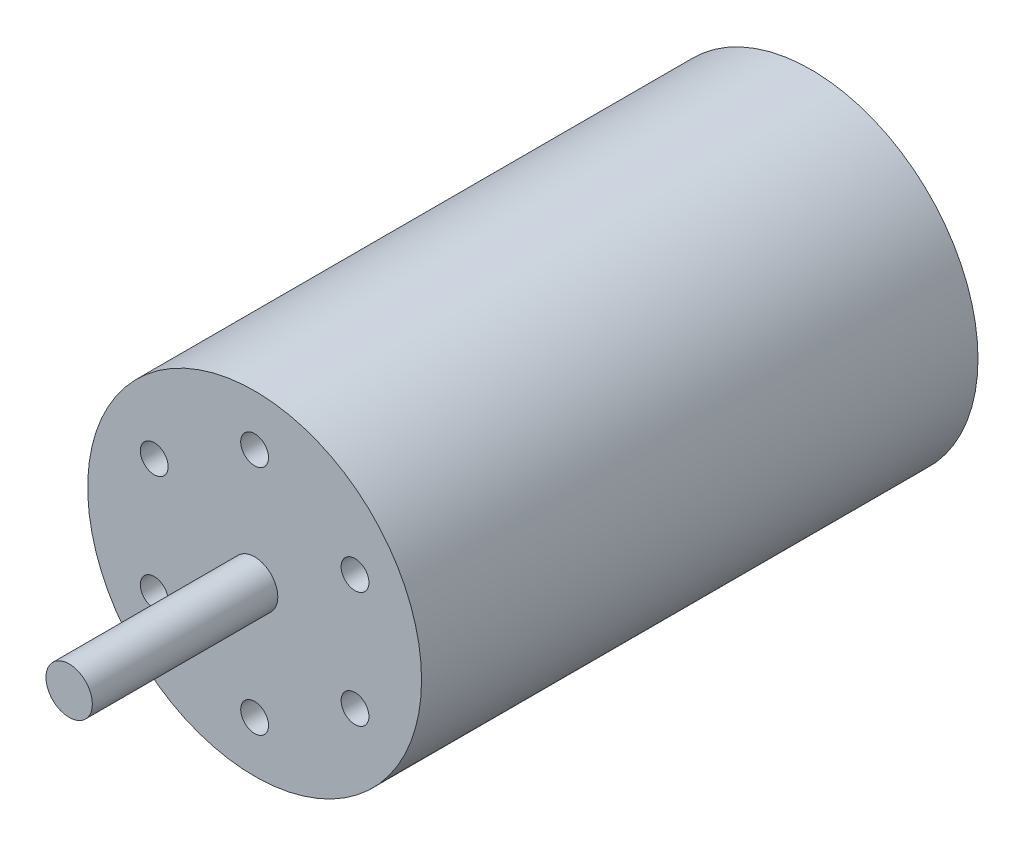
from build123d import *

# Parameters (mm, degrees)
SKETCH1_R           = 18
BOSS_EXTRUDE1_DEPTH = 60
SKETCH2_R           = 2.5
BOSS_EXTRUDE2_DEPTH = 20
SKETCH3_R           = 1.5
CUT_EXTRUDE1_DEPTH  = 10


with BuildPart() as part:
    # Sketch1 → Boss-Extrude1 (new body)
    with BuildSketch(Plane.XY):
        Circle(SKETCH1_R)
    extrude(amount=BOSS_EXTRUDE1_DEPTH)

    # Sketch2 → Boss-Extrude2 (add)
    with BuildSketch(Plane.XY.offset(60)):
        Circle(SKETCH2_R)
    extrude(amount=BOSS_EXTRUDE2_DEPTH)

    # Sketch3 → Cut-Extrude1 (cut)
    with BuildSketch(Plane.XY.offset(60)):
        with Locations((0, 12.5)):
            Circle(SKETCH3_R)
        with Locations((10.825317547, 6.25)):
            Circle(SKETCH3_R)
        with Locations((10.825317547, -6.25)):
            Circle(SKETCH3_R)
        with Locations((0, -12.5)):
            Circle(SKETCH3_R)
        with Locations((-10.825317547, -6.25)):
            Circle(SKETCH3_R)
        with Locations((-10.825317547, 6.25)):
            Circle(SKETCH3_R)
    extrude(amount=-CUT_EXTRUDE1_DEPTH, mode=Mode.SUBTRACT)


solid = part.part
